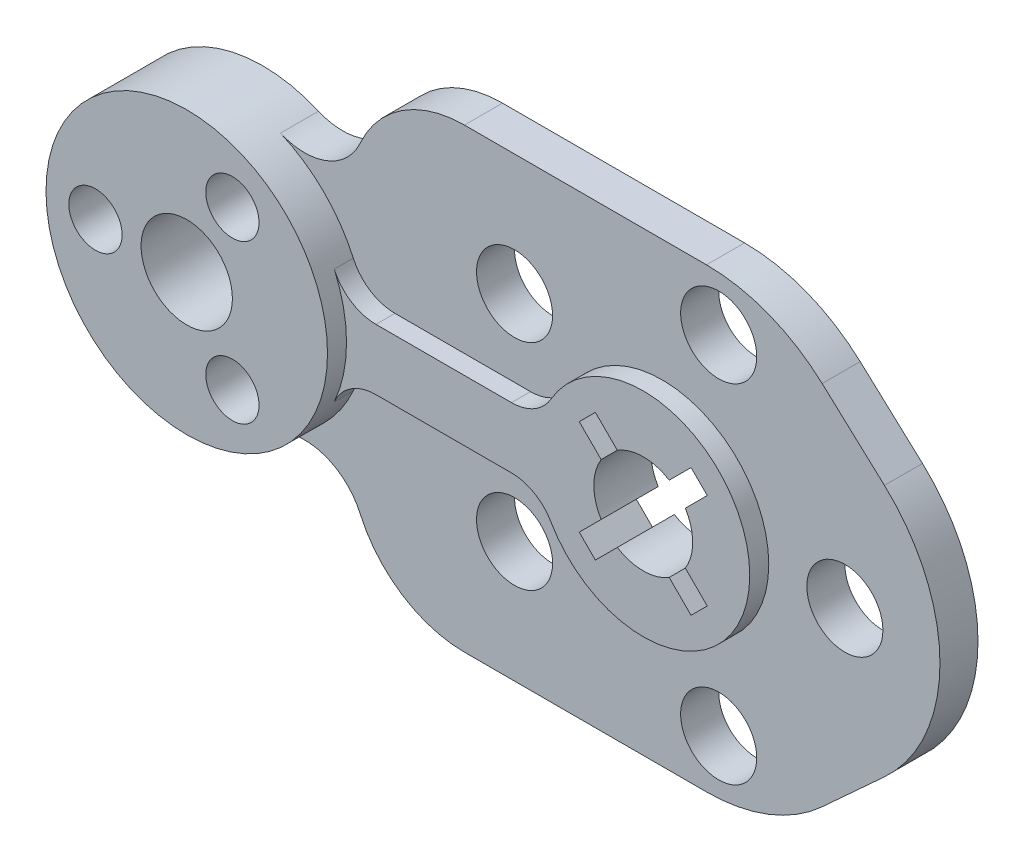
from build123d import *

# Parameters (mm, degrees)
SKETCH_1_R      = 10
EXTRUDE_1_DEPTH = 10
SKETCH_1_3_R    = 7
SKETCH_1_3_R_2  = 12
EXTRUDE_2_DEPTH = 20
EXTRUDE_3_DEPTH = 15


with BuildPart() as part:
    # Эскиз1 → Бобышка-Вытянуть1 (new body)
    with BuildSketch(Plane.XY):
        with BuildLine():
            ThreePointArc((33.777631107, 15.102040816), (38.204732973, 9.930851322), (44.732538493, 8))
            Line((44.732538493, 8), (80.358983849, 8))
            ThreePointArc((80.358983849, 8), (86.358983849, 9.607695155), (90.751288694, 14))
            ThreePointArc((90.751288694, 14), (143, 0), (90.751288694, -14))
            ThreePointArc((90.751288694, -14), (86.358983849, -9.607695155), (80.358983849, -8))
            Line((80.358983849, -8), (44.732538493, -8))
            ThreePointArc((44.732538493, -8), (38.204732973, -9.930851322), (33.777631107, -15.102040816))
            ThreePointArc((33.777631107, -15.102040816), (25.981771895, -26.342883843), (14.634400462, -33.982853369))
            ThreePointArc((14.634400462, -33.982853369), (26.793614992, -33.778427283), (35.584428164, -42.181396508))
            ThreePointArc((35.584428164, -42.181396508), (46.651328728, -55.153944971), (63, -60))
            Line((63, -60), (126.630372484, -60))
            ThreePointArc((126.630372484, -60), (142.940084207, -56.940354118), (157.031931827, -48.177480156))
            Line((157.031931827, -48.177480156), (173.401559343, -33.177480156))
            ThreePointArc((173.401559343, -33.177480156), (188, -1.233e-06), (173.401561161, 33.177478491))
            Line((173.401561161, 33.177478491), (157.031931827, 48.177480156))
            ThreePointArc((157.031931827, 48.177480156), (142.940084207, 56.940354118), (126.630372484, 60))
            Line((126.630372484, 60), (115, 60))
            Line((115, 60), (63, 60))
            ThreePointArc((63, 60), (46.651328728, 55.153944971), (35.584428164, 42.181396508))
            ThreePointArc((35.584428164, 42.181396508), (26.793614992, 33.778427283), (14.634400462, 33.982853369))
            ThreePointArc((14.634400462, 33.982853369), (25.981771895, 26.342883843), (33.777631107, 15.102040816))
        make_face()
        with Locations((129.83281573, -45.650712782)):
            Circle(SKETCH_1_R, mode=Mode.SUBTRACT)
        with Locations((76.16718427, -28.21369211)):
            Circle(SKETCH_1_R, mode=Mode.SUBTRACT)
        with Locations((163, 0)):
            Circle(SKETCH_1_R, mode=Mode.SUBTRACT)
        with Locations((76.16718427, 28.21369211)):
            Circle(SKETCH_1_R, mode=Mode.SUBTRACT)
        with Locations((129.83281573, 45.650712782)):
            Circle(SKETCH_1_R, mode=Mode.SUBTRACT)
    extrude(amount=EXTRUDE_1_DEPTH)

    # Эскиз1<3> → Бобышка-Вытянуть2 (add)
    with BuildSketch(Plane.XY):
        with BuildLine():
            ThreePointArc((37, 0), (36.185441485, 7.720998933), (33.777631107, 15.102040816))
            ThreePointArc((33.777631107, 15.102040816), (25.981771895, 26.342883843), (14.634400462, 33.982853369))
            ThreePointArc((14.634400462, 33.982853369), (-37, 0), (14.634400462, -33.982853369))
            ThreePointArc((14.634400462, -33.982853369), (25.981771895, -26.342883843), (33.777631107, -15.102040816))
            ThreePointArc((33.777631107, -15.102040816), (36.185441485, -7.720998933), (37, 0))
        make_face()
        with Locations((12, -20.784609691)):
            Circle(SKETCH_1_3_R, mode=Mode.SUBTRACT)
        with Locations((-24, 0)):
            Circle(SKETCH_1_3_R, mode=Mode.SUBTRACT)
        Circle(SKETCH_1_3_R_2, mode=Mode.SUBTRACT)
        with Locations((12, 20.784609691)):
            Circle(SKETCH_1_3_R, mode=Mode.SUBTRACT)
    extrude(amount=EXTRUDE_2_DEPTH)

    # Эскиз1<4> → Бобышка-Вытянуть3 (add)
    with BuildSketch(Plane.XY):
        with BuildLine():
            Line((80.358983849, 8), (44.732538493, 8))
            ThreePointArc((44.732538493, 8), (38.204732973, 9.930851322), (33.777631107, 15.102040816))
            ThreePointArc((33.777631107, 15.102040816), (36.185441485, 7.720998933), (37, 0))
            ThreePointArc((37, 0), (36.185441485, -7.720998933), (33.777631107, -15.102040816))
            ThreePointArc((33.777631107, -15.102040816), (38.204732973, -9.930851322), (44.732538493, -8))
            Line((44.732538493, -8), (80.358983849, -8))
            ThreePointArc((80.358983849, -8), (86.358983849, -9.607695155), (90.751288694, -14))
            ThreePointArc((90.751288694, -14), (143, 0), (90.751288694, 14))
            ThreePointArc((90.751288694, 14), (86.358983849, 9.607695155), (80.358983849, 8))
        make_face()
        with BuildLine():
            Line((98.1817412, 12.575618113), (100.303061543, 14.696938457))
            Line((100.303061543, 14.696938457), (102.424381887, 16.8182588))
            Line((102.424381887, 16.8182588), (108.177048434, 11.065592254))
            ThreePointArc((108.177048434, 11.065592254), (115, 13), (121.822951566, 11.065592254))
            Line((121.822951566, 11.065592254), (127.575618113, 16.8182588))
            Line((127.575618113, 16.8182588), (129.696938457, 14.696938457))
            Line((129.696938457, 14.696938457), (131.8182588, 12.575618113))
            Line((131.8182588, 12.575618113), (126.065592254, 6.822951566))
            ThreePointArc((126.065592254, 6.822951566), (128, 0), (126.065592254, -6.822951566))
            Line((126.065592254, -6.822951566), (131.8182588, -12.575618113))
            Line((131.8182588, -12.575618113), (129.696938457, -14.696938457))
            Line((129.696938457, -14.696938457), (127.575618113, -16.8182588))
            Line((127.575618113, -16.8182588), (121.822951566, -11.065592254))
            ThreePointArc((121.822951566, -11.065592254), (115, -13), (108.177048434, -11.065592254))
            Line((108.177048434, -11.065592254), (102.424381887, -16.8182588))
            Line((102.424381887, -16.8182588), (100.303061543, -14.696938457))
            Line((100.303061543, -14.696938457), (98.1817412, -12.575618113))
            Line((98.1817412, -12.575618113), (103.934407746, -6.822951566))
            ThreePointArc((103.934407746, -6.822951566), (102, 0), (103.934407746, 6.822951566))
            Line((103.934407746, 6.822951566), (98.1817412, 12.575618113))
        make_face(mode=Mode.SUBTRACT)
    extrude(amount=EXTRUDE_3_DEPTH)


solid = part.part
